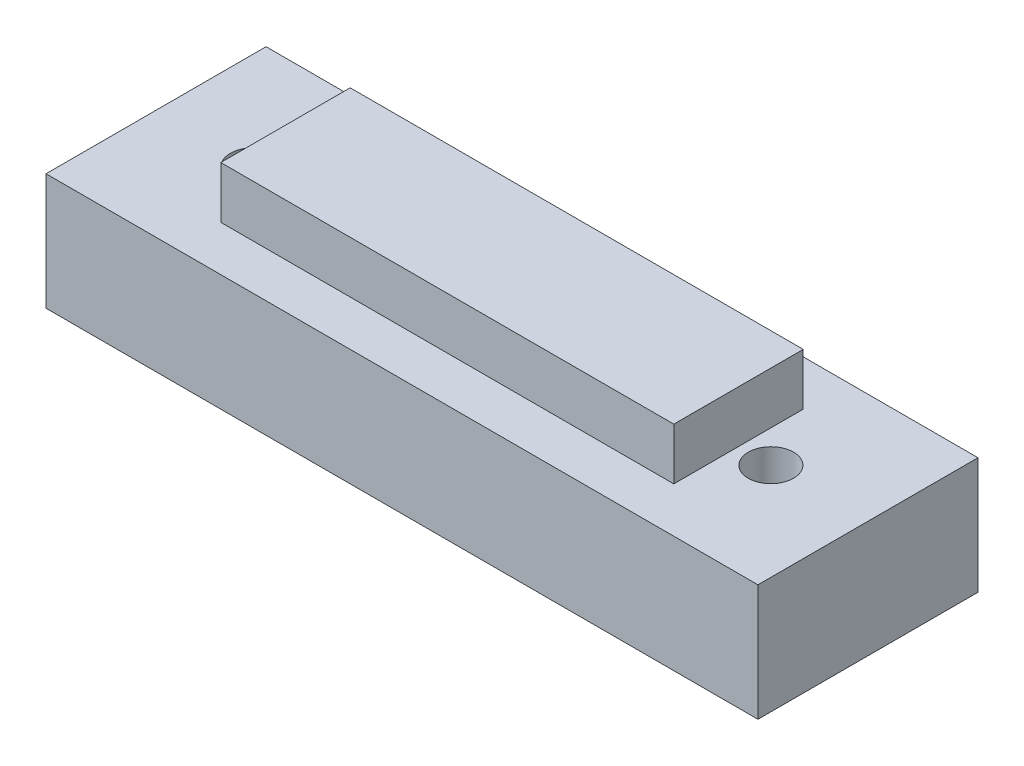
from build123d import *

# Parameters (mm, degrees)
F_01_BASE_PROFILE_W           = 110
F_01_BASE_PROFILE_H           = 34
F_01_BASE_PROFILE_R           = 3.5
F_01_BASE_EXTRUDE_DEPTH       = 18
F_02_BOSS_PROFILE_W           = 70
F_02_BOSS_PROFILE_H           = 20
F_02_REINFORCEMENT_BOSS_DEPTH = 26


with BuildPart() as part:
    # 01_Base_Profile → 01_Base_Extrude (new body)
    with BuildSketch(Plane(origin=(0, 0, 0), x_dir=(1, 0, 0), z_dir=(0, 1, 0))):
        Rectangle(F_01_BASE_PROFILE_W, F_01_BASE_PROFILE_H)
        with Locations(Location((-40, 0, 0), (0, 0, 270))):
            Circle(F_01_BASE_PROFILE_R, mode=Mode.SUBTRACT)
        with Locations(Location((40, 0, 0), (0, 0, 270))):
            Circle(F_01_BASE_PROFILE_R, mode=Mode.SUBTRACT)
    extrude(amount=F_01_BASE_EXTRUDE_DEPTH)

    # 02_Boss_Profile → 02_Reinforcement_Boss (add)
    with BuildSketch(Plane(origin=(0, 0, 0), x_dir=(1, 0, 0), z_dir=(0, 1, 0))):
        Rectangle(F_02_BOSS_PROFILE_W, F_02_BOSS_PROFILE_H)
    extrude(amount=F_02_REINFORCEMENT_BOSS_DEPTH)


solid = part.part
